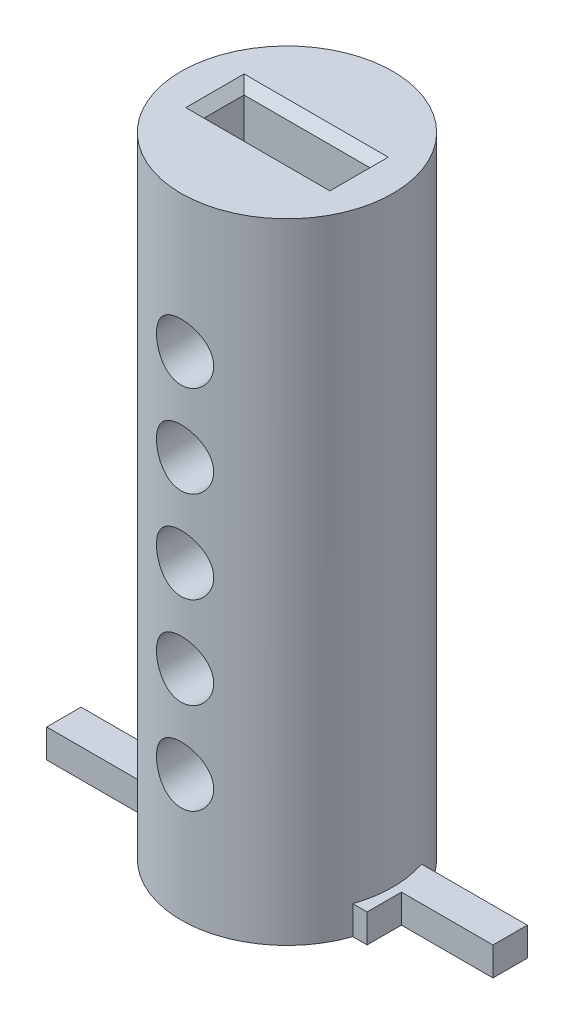
from build123d import *

# Parameters (mm, degrees)
SKETCH1_R           = 9.25
BOSS_EXTRUDE1_DEPTH = 55
SKETCH2_W           = 11
SKETCH2_H           = 3.5
CUT_EXTRUDE1_DEPTH  = 51
CHAMFER1_SIZE       = 0.8
SKETCH3_R           = 2.5
CUT_EXTRUDE2_DEPTH  = 10
SKETCH5_W           = 6
SKETCH5_H           = 2.5
BOSS_EXTRUDE2_DEPTH = 20
SKETCH6_W           = 6
SKETCH6_H           = 2.5
BOSS_EXTRUDE3_DEPTH = 10
SKETCH8_W           = 8
SKETCH8_H           = 3
CUT_EXTRUDE3_DEPTH  = 10


with BuildPart() as part:
    # Sketch1 → Boss-Extrude1 (new body)
    with BuildSketch(Plane(origin=(0, 0, 0), x_dir=(1, 0, 0), z_dir=(0, 1, 0))):
        with Locations(Location((0, 0, 0), (0, 0, 270))):
            Circle(SKETCH1_R)
    extrude(amount=BOSS_EXTRUDE1_DEPTH)

    # Sketch2 → Cut-Extrude1 (cut)
    with BuildSketch(Plane(origin=(0, 55, 0), x_dir=(1, 0, 0), z_dir=(0, 1, 0))):
        Rectangle(SKETCH2_W, SKETCH2_H)
    extrude(amount=-CUT_EXTRUDE1_DEPTH, mode=Mode.SUBTRACT)

    # Chamfer1
    chamfer1_edges = [part.edges().sort_by_distance(p)[0] for p in [
        (5.5, 55, 0),
        (0, 55, -1.75),
        (-5.5, 55, 0),
        (0, 55, 1.75),
    ]]
    chamfer(chamfer1_edges, length=CHAMFER1_SIZE)

    # Sketch3 → Cut-Extrude2 (cut)
    with BuildSketch(Plane.XY.offset(10)):
        with Locations((0, 43)):
            Circle(SKETCH3_R)
        with Locations((0, 35)):
            Circle(SKETCH3_R)
        with Locations((0, 27)):
            Circle(SKETCH3_R)
        with Locations((0, 19)):
            Circle(SKETCH3_R)
        with Locations((0, 11)):
            Circle(SKETCH3_R)
    extrude(amount=-CUT_EXTRUDE2_DEPTH, mode=Mode.SUBTRACT)

    # Sketch5 → Boss-Extrude2 (add)
    with BuildSketch(Plane(origin=(18, 0, 0), x_dir=(0, 0, -1), z_dir=(1, 0, 0))):
        with Locations((0, 1.25)):
            Rectangle(SKETCH5_W, SKETCH5_H)
    extrude(amount=-BOSS_EXTRUDE2_DEPTH)

    # Sketch6 → Boss-Extrude3 (add)
    with BuildSketch(Plane(origin=(-18, 0, 0), x_dir=(0, 0, -1), z_dir=(1, 0, 0))):
        with Locations((0, 1.25)):
            Rectangle(SKETCH6_W, SKETCH6_H)
    extrude(amount=BOSS_EXTRUDE3_DEPTH)

    # Sketch8 → Cut-Extrude3 (cut)
    with BuildSketch(Plane.XZ):
        with Locations((14, 1.5)):
            Rectangle(SKETCH8_W, SKETCH8_H)
        with Locations((-14, -1.5)):
            Rectangle(SKETCH8_W, SKETCH8_H)
    extrude(amount=-CUT_EXTRUDE3_DEPTH, mode=Mode.SUBTRACT)


solid = part.part
